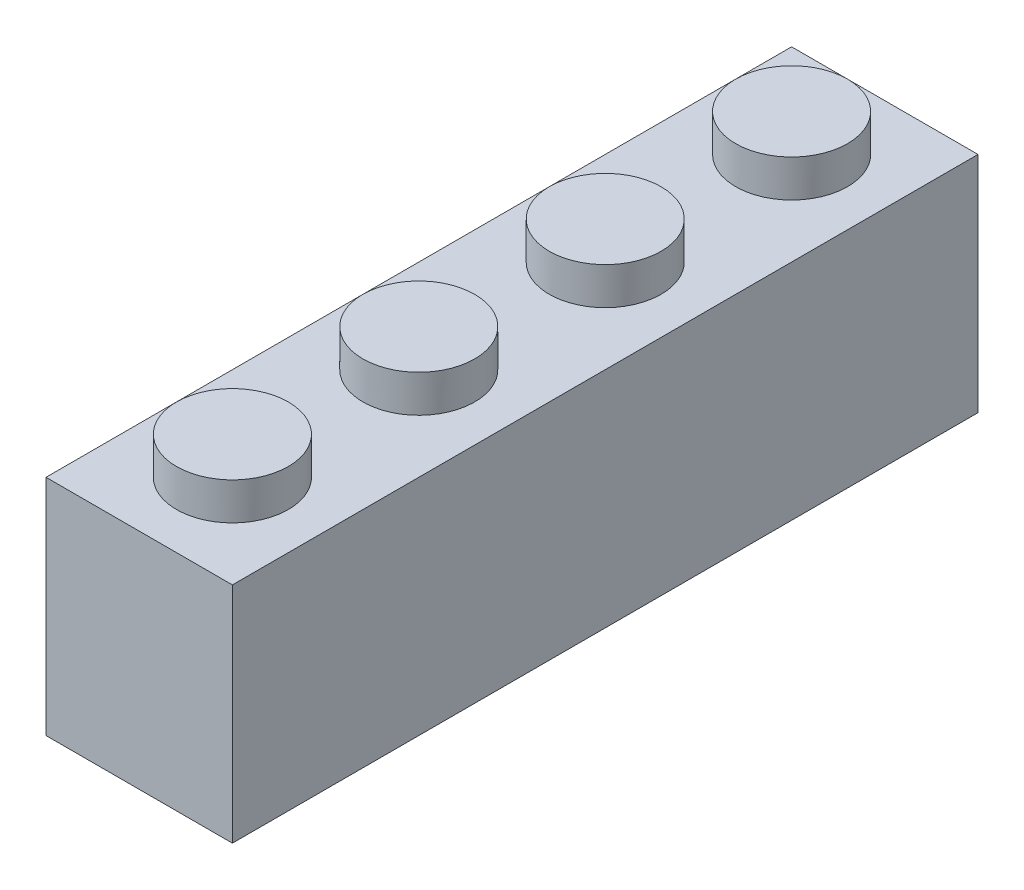
from build123d import *

# Parameters (mm, degrees)
SKETCH1_W            = 8
SKETCH1_H            = 32
BOSS_EXTRUDE1_DEPTH  = 9.6
SKETCH2_R            = 2.4
BOSS_EXTRUDE2_DEPTH  = 1.6
LPATTERN1_COUNT      = 2
LPATTERN1_PITCH      = 8
LPATTERN1_COUNT_DIR2 = 4
LPATTERN1_PITCH_DIR2 = 8
SHELL1_T             = -1.6


with BuildPart() as part:
    # Sketch1 → Boss-Extrude1 (new body)
    with BuildSketch(Plane(origin=(0, 0, 0), x_dir=(1, 0, 0), z_dir=(0, 1, 0))):
        with Locations((4, 16)):
            Rectangle(SKETCH1_W, SKETCH1_H)
    extrude(amount=BOSS_EXTRUDE1_DEPTH)

    # Sketch2 → Boss-Extrude2 (add)
    with BuildSketch(Plane(origin=(0, 9.6, 0), x_dir=(1, 0, 0), z_dir=(0, 1, 0))):
        with Locations(Location((4, 4, 0), (0, 0, 90))):
            Circle(SKETCH2_R)
    boss_extrude2 = extrude(amount=BOSS_EXTRUDE2_DEPTH)

    # LPattern1: Boss-Extrude2 2 × 4, 4 skipped
    with Locations(*[(i * LPATTERN1_PITCH, 0, -j * LPATTERN1_PITCH_DIR2) for i in range(LPATTERN1_COUNT) for j in range(LPATTERN1_COUNT_DIR2) if (i, j) not in ((0, 0), (1, 0), (1, 1), (1, 2), (1, 3))]):
        add(boss_extrude2)

    # Shell1
    shell1_openings = [part.faces().sort_by_distance(p)[0] for p in [
        (4, 0, -16),
    ]]
    offset(amount=SHELL1_T, openings=shell1_openings, kind=Kind.INTERSECTION)


solid = part.part
